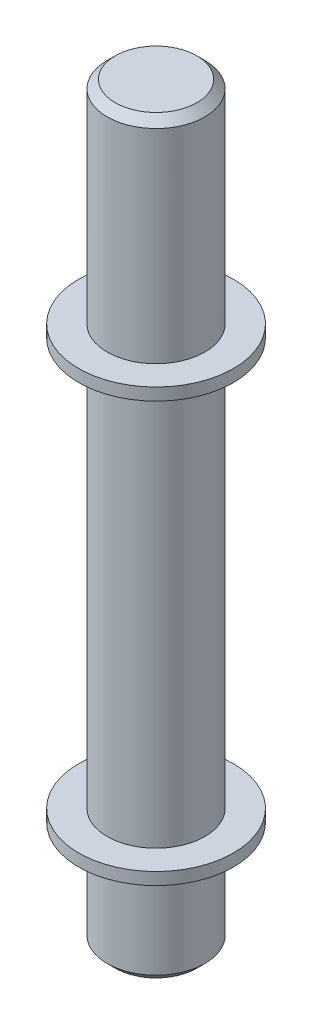
from build123d import *

# Parameters (mm, degrees)
CHAMFER1_SIZE = 2


with BuildPart() as part:
    # Sketch2 → Revolve1 (revolve)
    with BuildSketch(Plane.XY, mode=Mode.PRIVATE) as revolve1_sk:
        Polygon((12, 29), (12, 129), (19, 129), (19, 132), (12, 132), (12, 184), (0, 184), (0, 0), (12, 0), (12, 26), (19, 26), (19, 29), align=None)
    revolve(revolve1_sk.sketch.rotate(Axis((0, 0, 0), (0, 1, 0)), 90), axis=Axis((0, 0, 0), (0, 1, 0)))

    # Chamfer1
    chamfer1_edges = [part.edges().sort_by_distance(p)[0] for p in [
        (0, 184, 12),
        (0, 0, 12),
    ]]
    chamfer(chamfer1_edges, length=CHAMFER1_SIZE)


solid = part.part
